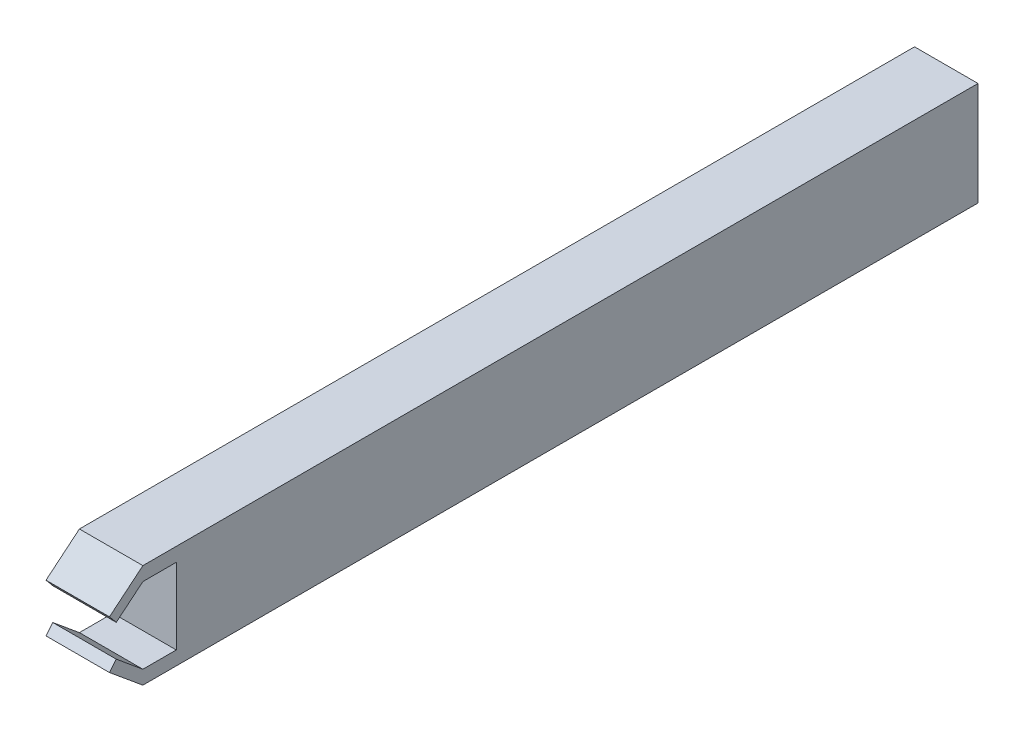
from build123d import *

# Parameters (mm, degrees)
SKETCH1_W           = 19
SKETCH1_H           = 31
BOSS_EXTRUDE1_DEPTH = 240
BOSS_EXTRUDE2_DEPTH = 19


with BuildPart() as part:
    # Sketch1 → Boss-Extrude1 (new body)
    with BuildSketch(Plane.XY):
        Rectangle(SKETCH1_W, SKETCH1_H)
    extrude(amount=BOSS_EXTRUDE1_DEPTH)

    # Sketch2 → Boss-Extrude2 (add)
    with BuildSketch(Plane.ZY.offset(9.5)):
        Polygon((240, 15.5), (250, 15.5), (260, 7.226546943), (257.968239385, 4.770788022), (250, 11.363273472), (240, 11.363273472), align=None)
        Polygon((240, -15.5), (240, -11.363273472), (250, -11.363273472), (257.968239385, -4.770788022), (260, -7.226546943), (250, -15.5), align=None)
    extrude(amount=-BOSS_EXTRUDE2_DEPTH)


solid = part.part
